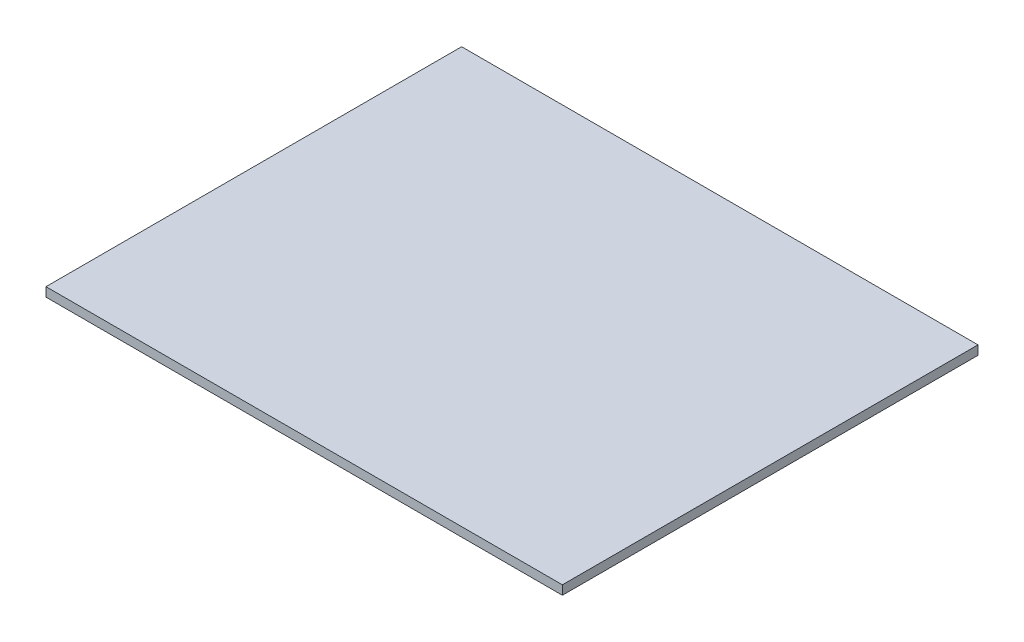
from build123d import *

# Parameters (mm, degrees)
SKETCH1_W           = 246
SKETCH1_H           = 198
BOSS_EXTRUDE1_DEPTH = 4.33


with BuildPart() as part:
    # Sketch1 → Boss-Extrude1 (new body)
    with BuildSketch(Plane(origin=(0, 0, 0), x_dir=(1, 0, 0), z_dir=(0, 1, 0))):
        Rectangle(SKETCH1_W, SKETCH1_H)
    extrude(amount=BOSS_EXTRUDE1_DEPTH)


solid = part.part
